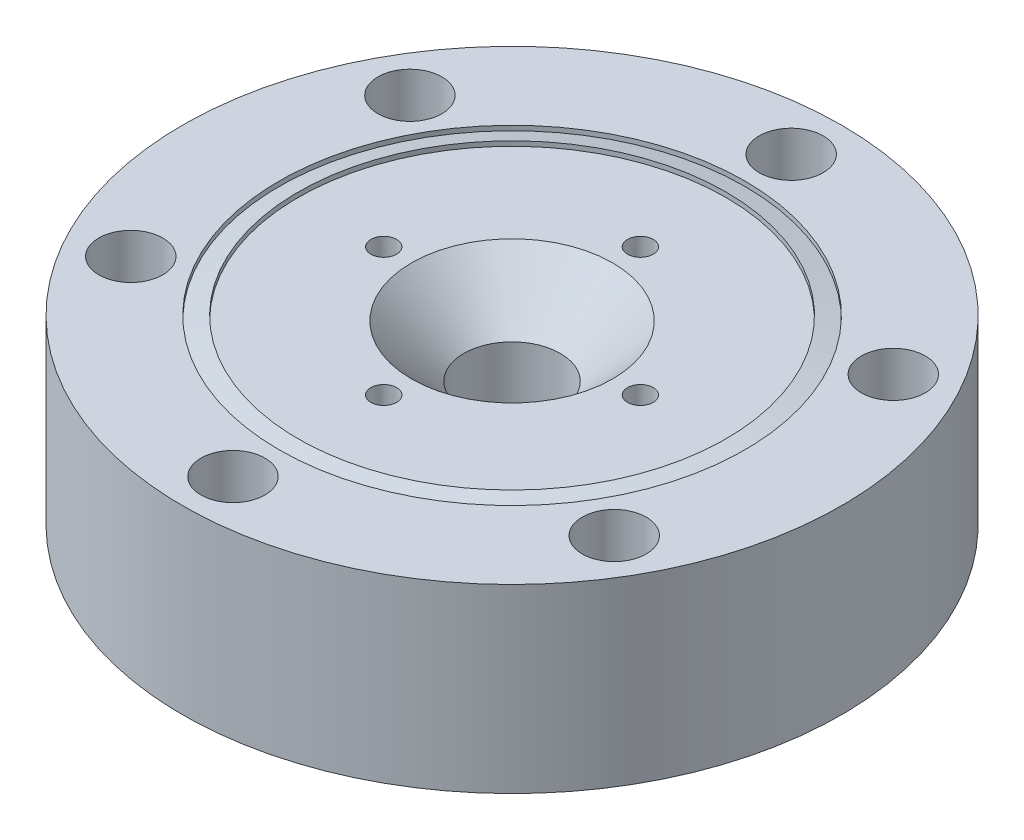
from build123d import *

# Parameters (mm, degrees)
SKETCH1_R           = 34.671
BOSS_EXTRUDE1_DEPTH = 19.05
SKETCH5_R           = 5.08
CUT_EXTRUDE1_DEPTH  = 53.602841957
CHAMFER1_SIZE       = 6
CIRPATTERN1_COUNT   = 4
SKETCH8_R           = 3.3655
CUT_EXTRUDE2_DEPTH  = 53.602841957
CIRPATTERN2_COUNT   = 6


with BuildPart() as part:
    # Sketch1 → Boss-Extrude1 (new body)
    with BuildSketch(Plane(origin=(0, 0, 0), x_dir=(1, 0, 0), z_dir=(0, 1, 0))):
        with Locations(Location((0, 0, 0), (0, 0, 90))):
            Circle(SKETCH1_R)
    extrude(amount=BOSS_EXTRUDE1_DEPTH)

    # Sketch5 → Cut-Extrude1 (cut, through all)
    with BuildSketch(Plane.XZ):
        with Locations(Location((0, 0, 0), (0, 0, 270))):
            Circle(SKETCH5_R)
    extrude(amount=-CUT_EXTRUDE1_DEPTH, mode=Mode.SUBTRACT)

    # Chamfer1
    chamfer1_edges = [part.edges().sort_by_distance(p)[0] for p in [
        (0, 19.05, 5.08),
    ]]
    chamfer(chamfer1_edges, length=CHAMFER1_SIZE)

    # Sketch6 → #6-32 Tapped Hole1 (revolve, cut)
    with BuildSketch(Plane(origin=(0, 19.05, -13.5), x_dir=(0, 0, 1), z_dir=(1, 0, 0))):
        Polygon((0, 0), (0, 10.81269403), (1.35255, 10), (1.35255, 0), align=None)
    f_6_32_tapped_hole1 = revolve(axis=Axis((0, 25.4, -13.5), (0, -1, 0)), mode=Mode.SUBTRACT)

    # CirPattern1: #6-32 Tapped Hole1 ×4 about axis
    cirpattern1_axis = Axis((0, 0, 0), (0, 1, 0))
    for i in range(1, CIRPATTERN1_COUNT):
        add(f_6_32_tapped_hole1.rotate(cirpattern1_axis, i * 360 / CIRPATTERN1_COUNT), mode=Mode.SUBTRACT)

    # Sketch8 → Cut-Extrude2 (cut, through all)
    with BuildSketch(Plane(origin=(0, 19.05, 0), x_dir=(1, 0, 0), z_dir=(0, 1, 0))):
        with Locations(Location((0, 29.3624, 0), (0, 0, 270))):
            Circle(SKETCH8_R)
    cut_extrude2 = extrude(amount=-CUT_EXTRUDE2_DEPTH, mode=Mode.SUBTRACT)

    # CirPattern2: Cut-Extrude2 ×6 about axis
    cirpattern2_axis = Axis((0, 0, 0), (0, 1, 0))
    for i in range(1, CIRPATTERN2_COUNT):
        add(cut_extrude2.rotate(cirpattern2_axis, i * 360 / CIRPATTERN2_COUNT), mode=Mode.SUBTRACT)

    # Sketch9 → Cut-Revolve1 (revolve, cut)
    with BuildSketch(Plane.XY, mode=Mode.PRIVATE) as cut_revolve1_sk:
        Polygon((0, -2.570803014), (0, 0.5), (22.5, 0.5), (22.5, 0), (24.5, 0.5), (24.5, -7.98797561), (0, -7.98797561), align=None)
    cut_revolve1 = revolve(cut_revolve1_sk.sketch.rotate(Axis((0, -2.570803014, 0), (0, 1, 0)), 90), axis=Axis((0, -2.570803014, 0), (0, 1, 0)), mode=Mode.SUBTRACT)

    # Mirror1: Cut-Revolve1 across plane
    add(cut_revolve1.mirror(Plane(origin=(0, 9.525, 0), x_dir=(0, 0, 1), z_dir=(0, -1, 0))), mode=Mode.SUBTRACT)


solid = part.part
